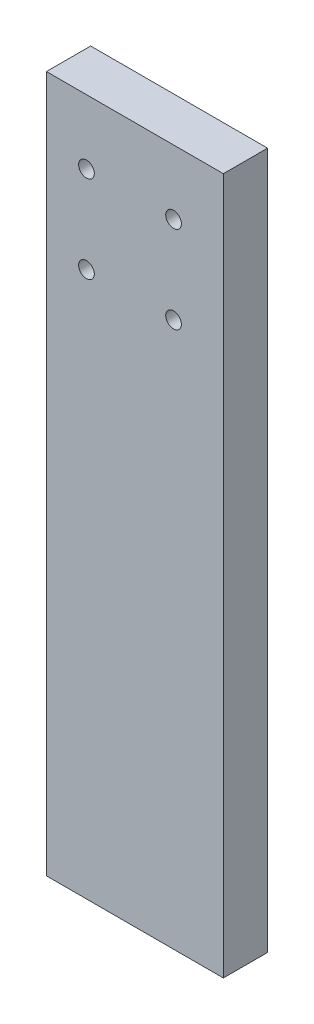
from build123d import *

# Parameters (mm, degrees)
CROQUIS1_W              = 50.8
CROQUIS1_H              = 200
CROQUIS1_R              = 2.25
SALIENTE_EXTRUIR1_DEPTH = 12.7
CROQUIS2_R              = 1.5
CORTAR_EXTRUIR1_DEPTH   = 20


with BuildPart() as part:
    # Croquis1 → Saliente-Extruir1 (new body)
    with BuildSketch(Plane.XY):
        with Locations((1.4, -38)):
            Rectangle(CROQUIS1_W, CROQUIS1_H)
        with Locations((-12.5, 43.5)):
            Circle(CROQUIS1_R, mode=Mode.SUBTRACT)
        with Locations((12.5, 43.5)):
            Circle(CROQUIS1_R, mode=Mode.SUBTRACT)
        with Locations((12.5, 18.5)):
            Circle(CROQUIS1_R, mode=Mode.SUBTRACT)
        with Locations((-12.5, 18.5)):
            Circle(CROQUIS1_R, mode=Mode.SUBTRACT)
    extrude(amount=SALIENTE_EXTRUIR1_DEPTH)

    # Croquis2 → Cortar-Extruir1 (cut)
    with BuildSketch(Plane.XZ.offset(138)):
        with Locations(Location((-16.1, 6.35, 0), (0, 0, 270))):
            Circle(CROQUIS2_R)
        with Locations(Location((18.9, 6.35, 0), (0, 0, 270))):
            Circle(CROQUIS2_R)
    extrude(amount=-CORTAR_EXTRUIR1_DEPTH, mode=Mode.SUBTRACT)


solid = part.part
